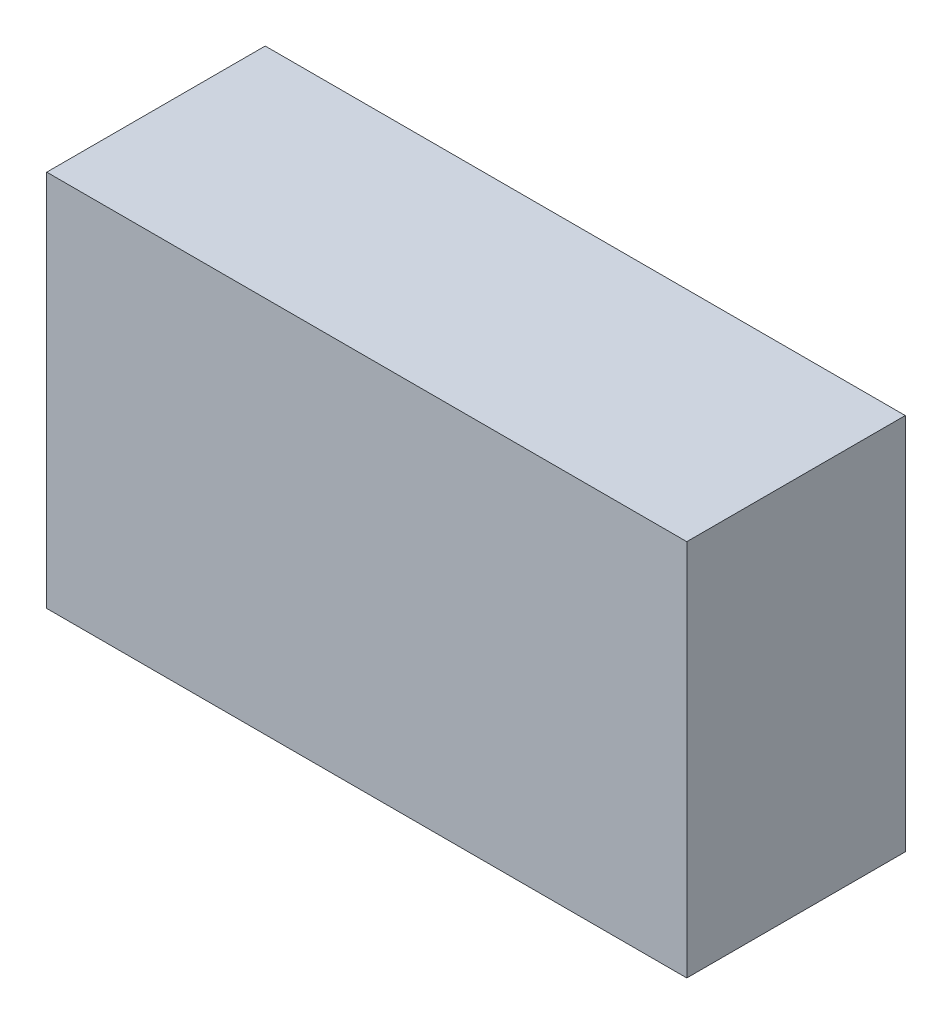
from build123d import *

# Parameters (mm, degrees)
SKETCH1_W                 = 21.24
SKETCH1_H                 = 12.54
BOSS_EXTRUDE1_DEPTH       = 7.25
SHELL1_T                  = -0.5
SHELL1_THICKNESS_2_FACE_W = 20.24
SHELL1_THICKNESS_2_FACE_H = 11.54
SHELL1_THICKNESS_2_DEPTH  = 0.3


with BuildPart() as part:
    # Sketch1 → Boss-Extrude1 (new body)
    with BuildSketch(Plane.XY):
        with Locations((-6.1555, 23.92)):
            Rectangle(SKETCH1_W, SKETCH1_H)
    extrude(amount=BOSS_EXTRUDE1_DEPTH)

    # Shell1
    shell1_openings = [part.faces().sort_by_distance(p)[0] for p in [
        (-6.1555, 23.92, 0),
    ]]
    offset(amount=SHELL1_T, openings=shell1_openings, kind=Kind.INTERSECTION)

    # Shell1 thickness 2 face (on inner face of the shell) → Shell1 thickness 2 (cut)
    with BuildSketch(Plane(origin=(-6.1555, 23.92, 6.75), x_dir=(1, 0, 0), z_dir=(0, 0, 1))):
        Rectangle(SHELL1_THICKNESS_2_FACE_W, SHELL1_THICKNESS_2_FACE_H)
    extrude(amount=SHELL1_THICKNESS_2_DEPTH, mode=Mode.SUBTRACT)


solid = part.part
